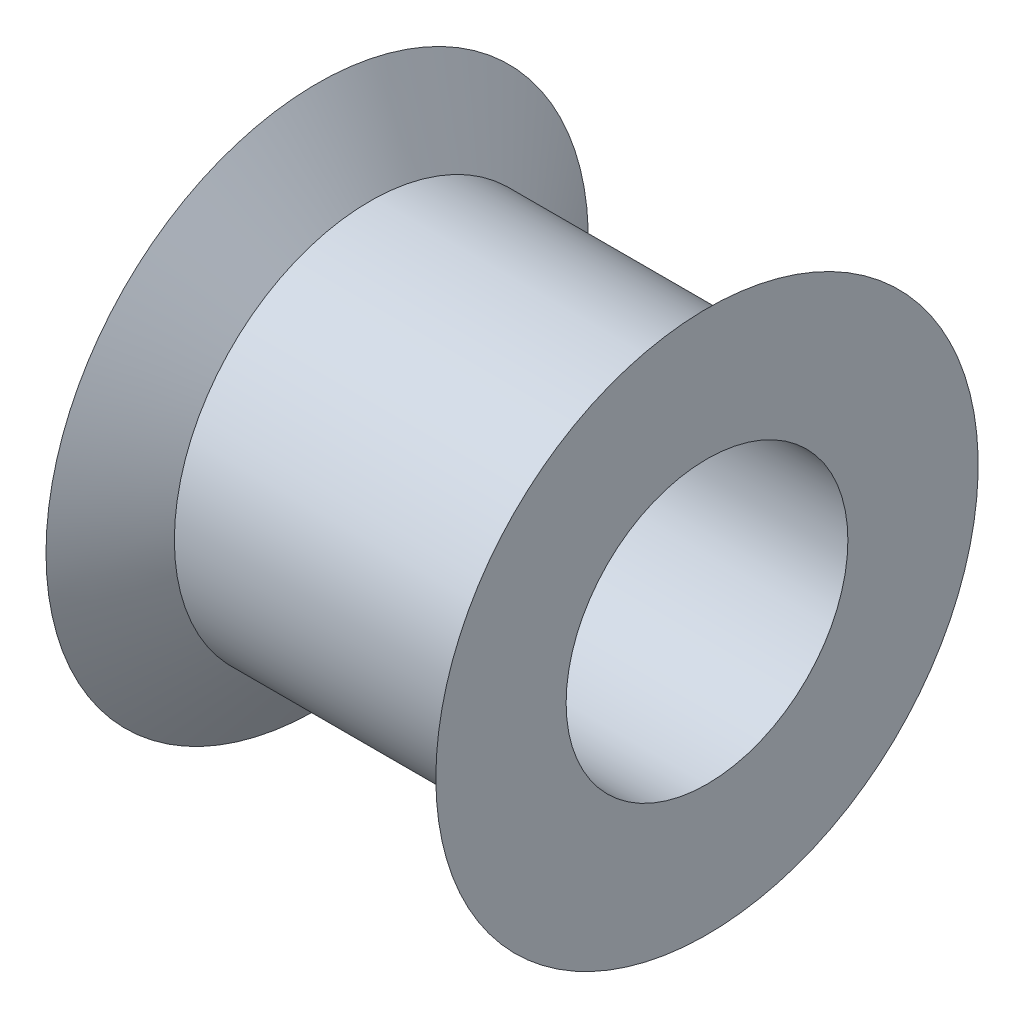
from build123d import *


with BuildPart() as part:
    # Sketch2 → Revolve1 (revolve)
    with BuildSketch(Plane.XY, mode=Mode.PRIVATE) as revolve1_sk:
        Polygon((0, 2.286), (6.3256, 2.286), (6.3256, 4.4), (5.467845766, 3.175), (0.857754234, 3.175), (0, 4.4), align=None)
    revolve(revolve1_sk.sketch.rotate(Axis((0, 0, 0), (1, 0, 0)), 90), axis=Axis((0, 0, 0), (1, 0, 0)))


solid = part.part
